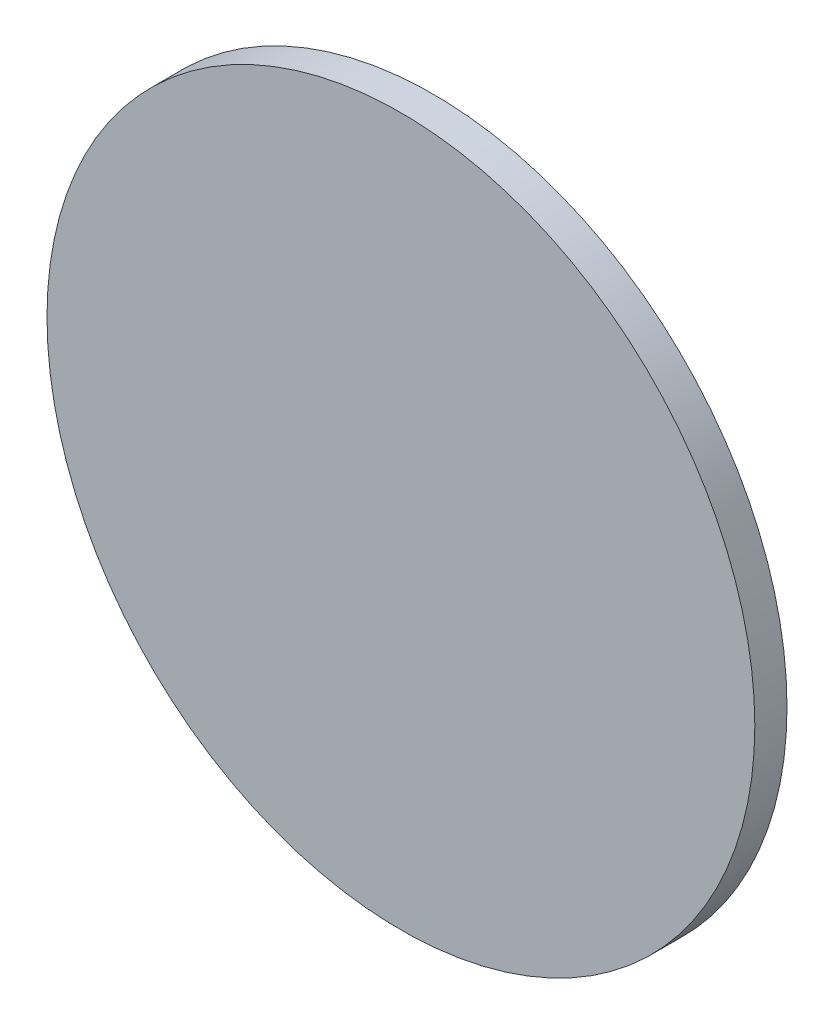
from build123d import *

# Parameters (mm, degrees)
CROQUIS1_R              = 33
SALIENTE_EXTRUIR1_DEPTH = 3


with BuildPart() as part:
    # Croquis1 → Saliente-Extruir1 (new body)
    with BuildSketch(Plane.XY):
        Circle(CROQUIS1_R)
    extrude(amount=SALIENTE_EXTRUIR1_DEPTH)


solid = part.part
